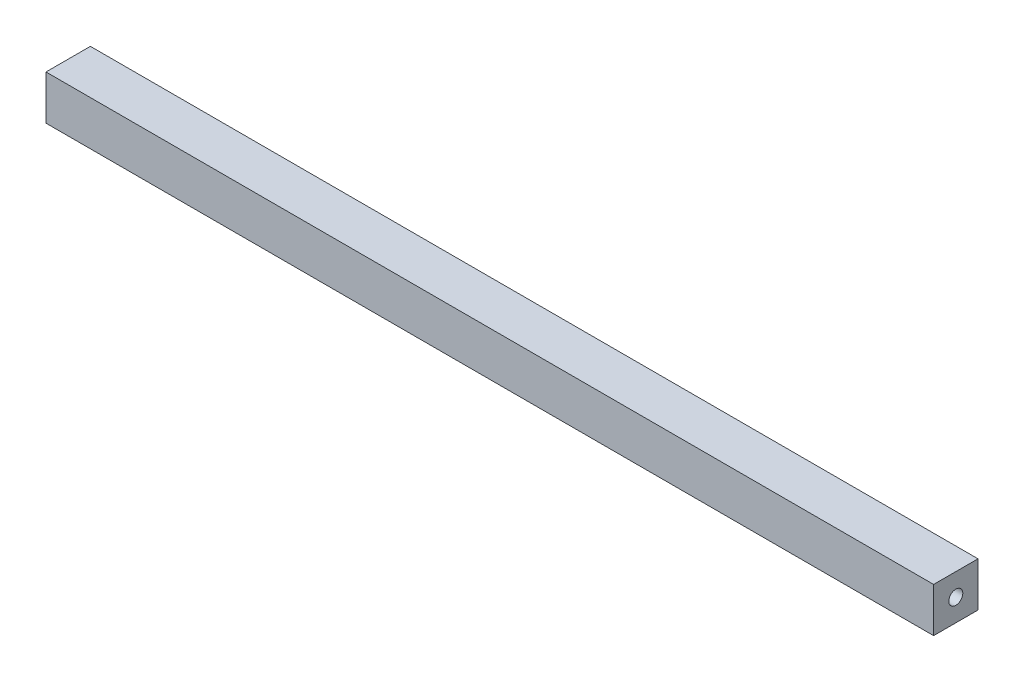
from build123d import *

# Parameters (mm, degrees)
SKETCH1_W           = 508
SKETCH1_H           = 25.4
BOSS_EXTRUDE1_DEPTH = 25.4
SKETCH2_R           = 4.0005
CUT_EXTRUDE1_DEPTH  = 509.79313085


with BuildPart() as part:
    # Sketch1 → Boss-Extrude1 (new body)
    with BuildSketch(Plane.XY):
        Rectangle(SKETCH1_W, SKETCH1_H)
    extrude(amount=BOSS_EXTRUDE1_DEPTH)

    # Sketch2 → Cut-Extrude1 (cut, through all)
    with BuildSketch(Plane.ZY.offset(254)):
        with Locations((12.7, 0)):
            Circle(SKETCH2_R)
    extrude(amount=-CUT_EXTRUDE1_DEPTH, mode=Mode.SUBTRACT)


solid = part.part
